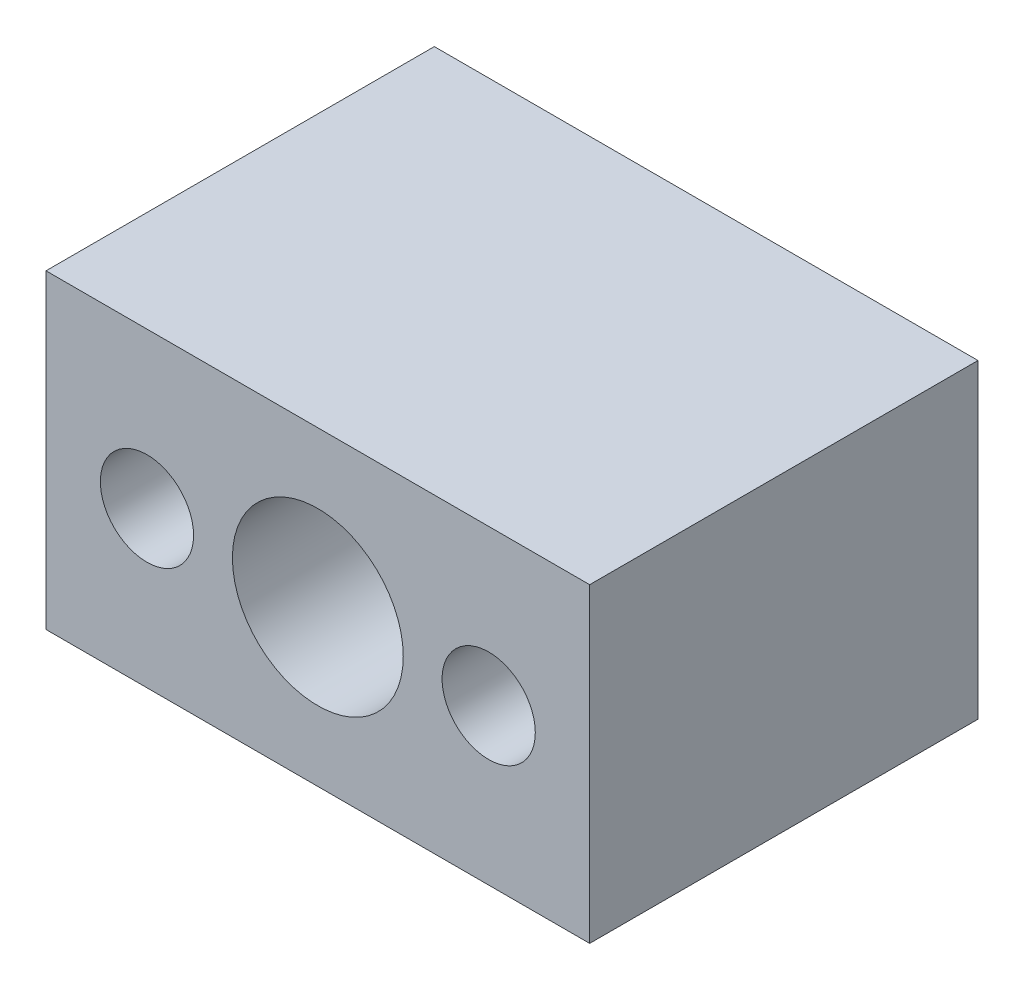
from build123d import *

# Parameters (mm, degrees)
SKETCH1_W           = 70
SKETCH1_H           = 40
BOSS_EXTRUDE1_DEPTH = 50
SKETCH2_R           = 11
CUT_EXTRUDE1_DEPTH  = 65.226162893
SKETCH3_R           = 6
CUT_EXTRUDE2_DEPTH  = 65.226162893


with BuildPart() as part:
    # Sketch1 → Boss-Extrude1 (new body)
    with BuildSketch(Plane.XY):
        Rectangle(SKETCH1_W, SKETCH1_H)
    extrude(amount=BOSS_EXTRUDE1_DEPTH)

    # Sketch2 → Cut-Extrude1 (cut, through all)
    with BuildSketch(Plane.XY.offset(50)):
        Circle(SKETCH2_R)
    extrude(amount=-CUT_EXTRUDE1_DEPTH, mode=Mode.SUBTRACT)

    # Sketch3 → Cut-Extrude2 (cut, through all)
    with BuildSketch(Plane.XY.offset(50)):
        with Locations((-22, 0)):
            Circle(SKETCH3_R)
        with Locations((22, 0)):
            Circle(SKETCH3_R)
    extrude(amount=-CUT_EXTRUDE2_DEPTH, mode=Mode.SUBTRACT)


solid = part.part
